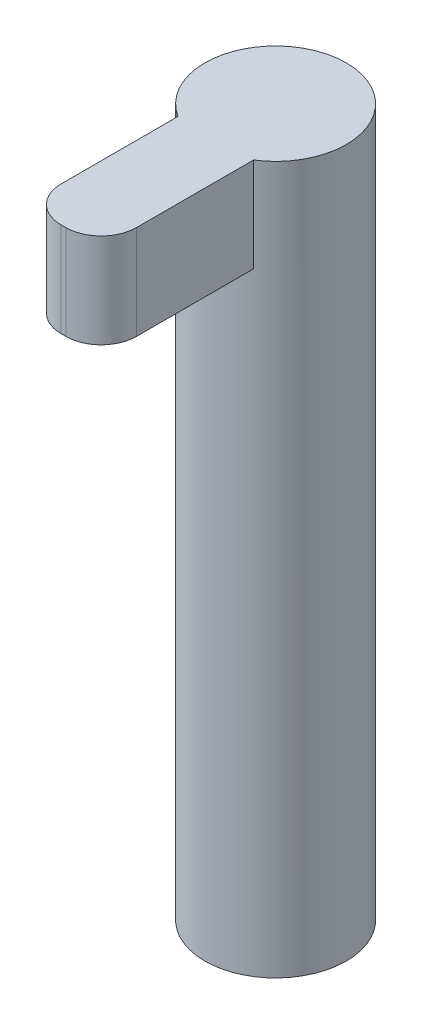
from build123d import *

# Parameters (mm, degrees)
CROQUIS1_R              = 3
SALIENTE_EXTRUIR1_DEPTH = 30
CROQUIS2_W              = 3.201408756
CROQUIS2_H              = 4
SALIENTE_EXTRUIR2_DEPTH = 9
REDONDEO2_R             = 1.5


with BuildPart() as part:
    # Croquis1 → Saliente-Extruir1 (new body)
    with BuildSketch(Plane(origin=(0, 0, 0), x_dir=(1, 0, 0), z_dir=(0, 1, 0))):
        with Locations(Location((0, 0, 0), (0, 0, 270))):
            Circle(CROQUIS1_R)
    extrude(amount=SALIENTE_EXTRUIR1_DEPTH)

    # Croquis2 → Saliente-Extruir2 (add)
    with BuildSketch(Plane.XY):
        with Locations((0, 28)):
            Rectangle(CROQUIS2_W, CROQUIS2_H)
    extrude(amount=SALIENTE_EXTRUIR2_DEPTH)

    # Redondeo2
    redondeo2_edges = [part.edges().sort_by_distance(p)[0] for p in [
        (1.600704378, 28, 9),
        (-1.600704378, 28, 9),
    ]]
    fillet(redondeo2_edges, radius=REDONDEO2_R)


solid = part.part
